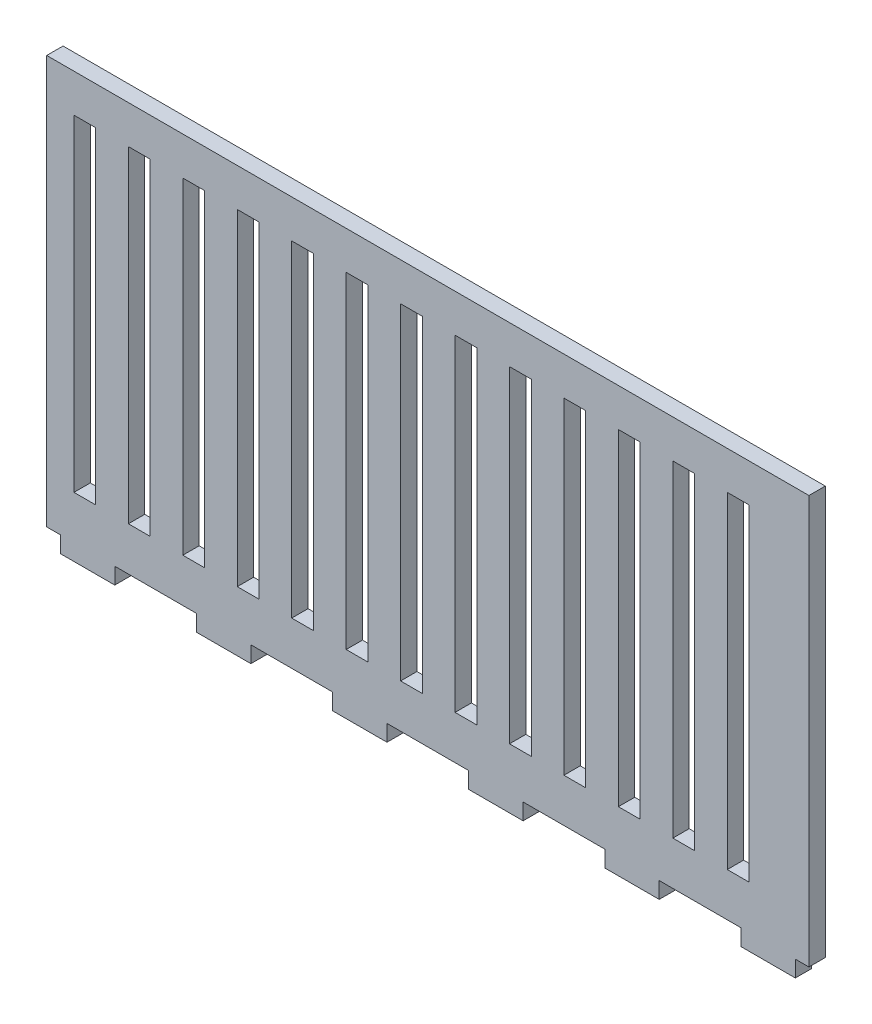
from build123d import *

# Parameters (mm, degrees)
BOSS_EXTRU_1_DEPTH      = 3
ESQUISSE2_W             = 4
ESQUISSE2_H             = 60
ENL_V_MAT_EXTRU_1_DEPTH = 3


with BuildPart() as part:
    # Esquisse1 → Boss.-Extru.1 (new body)
    with BuildSketch(Plane.XY):
        Polygon((-137.5, -3), (-127.5, -3), (-127.5, 0), (-112.5, 0), (-112.5, -3), (-102.5, -3), (-102.5, 0), (-87.5, 0), (-87.5, -3), (-77.5, -3), (-77.5, 0), (-62.5, 0), (-62.5, -3), (-52.5, -3), (-52.5, 0), (-37.5, 0), (-37.5, -3), (-27.5, -3), (-27.5, 0), (-12.5, 0), (-12.5, -3), (-2.5, -3), (-2.5, 0), (0, 0), (0, 75), (-140, 75), (-140, 0), (-137.5, 0), align=None)
    extrude(amount=BOSS_EXTRU_1_DEPTH)

    # Esquisse2 → Enlèv. mat.-Extru.1 (cut)
    with BuildSketch(Plane.XY.offset(3)):
        with Locations((-133, 38)):
            Rectangle(ESQUISSE2_W, ESQUISSE2_H)
        with Locations((-123, 38)):
            Rectangle(ESQUISSE2_W, ESQUISSE2_H)
        with Locations((-113, 38)):
            Rectangle(ESQUISSE2_W, ESQUISSE2_H)
        with Locations((-103, 38)):
            Rectangle(ESQUISSE2_W, ESQUISSE2_H)
        with Locations((-93, 38)):
            Rectangle(ESQUISSE2_W, ESQUISSE2_H)
        with Locations((-83, 38)):
            Rectangle(ESQUISSE2_W, ESQUISSE2_H)
        with Locations((-73, 38)):
            Rectangle(ESQUISSE2_W, ESQUISSE2_H)
        with Locations((-63, 38)):
            Rectangle(ESQUISSE2_W, ESQUISSE2_H)
        with Locations((-53, 38)):
            Rectangle(ESQUISSE2_W, ESQUISSE2_H)
        with Locations((-43, 38)):
            Rectangle(ESQUISSE2_W, ESQUISSE2_H)
        with Locations((-33, 38)):
            Rectangle(ESQUISSE2_W, ESQUISSE2_H)
        with Locations((-23, 38)):
            Rectangle(ESQUISSE2_W, ESQUISSE2_H)
        with Locations((-13, 38)):
            Rectangle(ESQUISSE2_W, ESQUISSE2_H)
    extrude(amount=-ENL_V_MAT_EXTRU_1_DEPTH, mode=Mode.SUBTRACT)


solid = part.part
